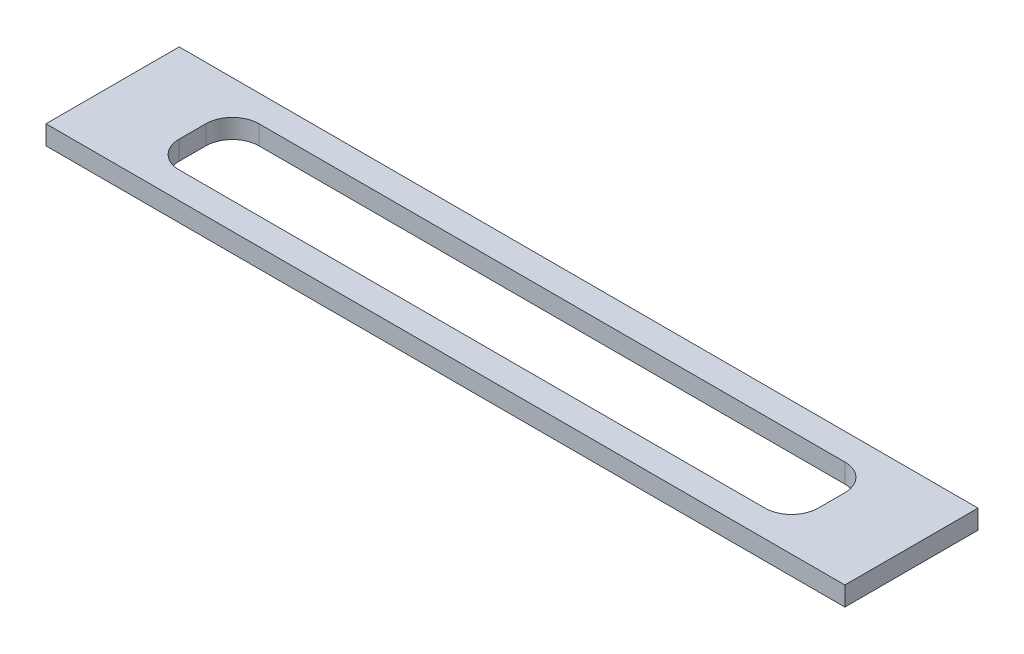
from build123d import *

# Parameters (mm, degrees)
SKETCH1_W           = 762
SKETCH1_H           = 127
BOSS_EXTRUDE1_DEPTH = 18.288
SKETCH3_W           = 609.6
SKETCH3_H           = 76.2
CUT_EXTRUDE1_DEPTH  = 713.731675746
FILLET1_R           = 25.4


with BuildPart() as part:
    # Sketch1 → Boss-Extrude1 (new body)
    with BuildSketch(Plane(origin=(0, 0, 0), x_dir=(1, 0, 0), z_dir=(0, 1, 0))):
        with Locations((-310.829571311, -106.863831041)):
            Rectangle(SKETCH1_W, SKETCH1_H)
    extrude(amount=BOSS_EXTRUDE1_DEPTH)

    # Sketch3 → Cut-Extrude1 (cut, through all)
    with BuildSketch(Plane(origin=(0, 18.288, 0), x_dir=(1, 0, 0), z_dir=(0, 1, 0))):
        with Locations((-310.829571311, -106.863831041)):
            Rectangle(SKETCH3_W, SKETCH3_H)
    extrude(amount=-CUT_EXTRUDE1_DEPTH, mode=Mode.SUBTRACT)

    # Fillet1
    fillet1_edges = [part.edges().sort_by_distance(p)[0] for p in [
        (-6.029571311, 9.144, 68.763831041),
        (-6.029571311, 9.144, 144.963831041),
        (-615.629571311, 9.144, 144.963831041),
        (-615.629571311, 9.144, 68.763831041),
    ]]
    fillet(fillet1_edges, radius=FILLET1_R)


solid = part.part
